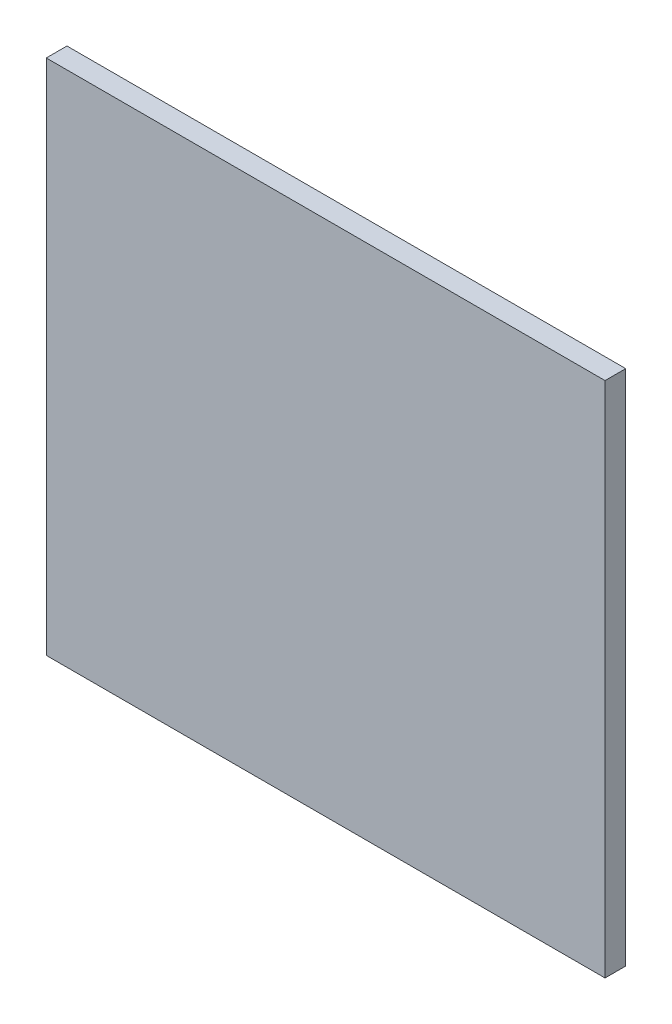
from build123d import *

# Parameters (mm, degrees)
SKETCH1_W           = 135
SKETCH1_H           = 125
BOSS_EXTRUDE1_DEPTH = 5


with BuildPart() as part:
    # Sketch1 → Boss-Extrude1 (new body)
    with BuildSketch(Plane.XY):
        Rectangle(SKETCH1_W, SKETCH1_H)
    extrude(amount=BOSS_EXTRUDE1_DEPTH)


solid = part.part
